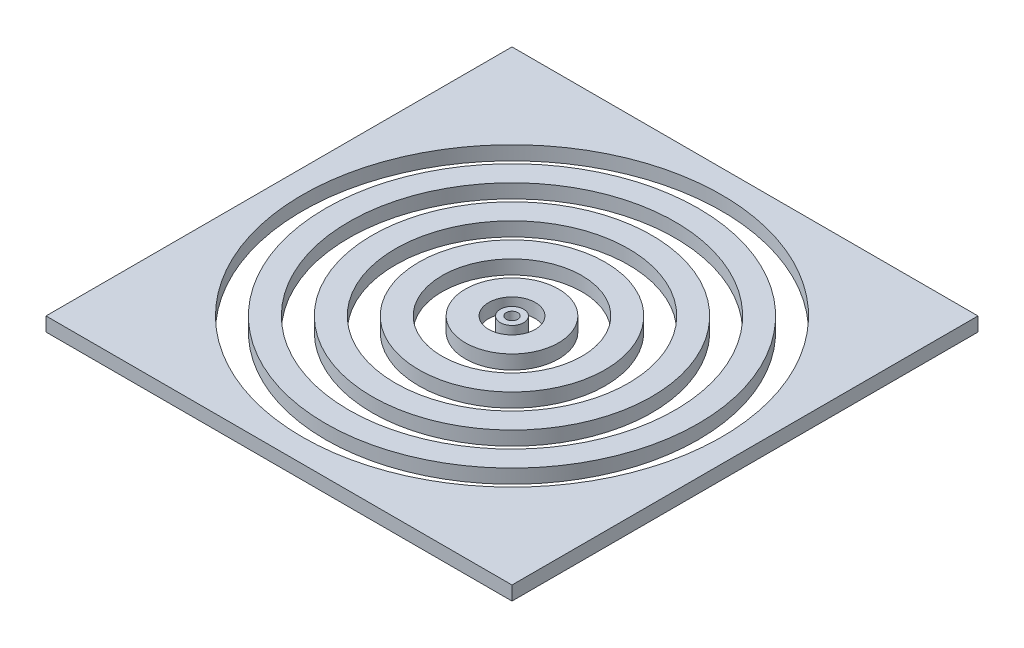
from build123d import *

# Parameters (mm, degrees)
SKETCH1_W           = 100
SKETCH1_H           = 100
BOSS_EXTRUDE1_DEPTH = 3
SKETCH2_R           = 45
CUT_EXTRUDE1_DEPTH  = 3
SKETCH3_R           = 40
BOSS_EXTRUDE2_DEPTH = 3
SKETCH4_R           = 35
CUT_EXTRUDE2_DEPTH  = 3
SKETCH5_R           = 30
BOSS_EXTRUDE3_DEPTH = 3
SKETCH6_R           = 25
CUT_EXTRUDE3_DEPTH  = 3
SKETCH7_R           = 20
BOSS_EXTRUDE4_DEPTH = 3
SKETCH8_R           = 15
CUT_EXTRUDE4_DEPTH  = 3
SKETCH9_R           = 10
BOSS_EXTRUDE5_DEPTH = 3
SKETCH10_R          = 5
CUT_EXTRUDE5_DEPTH  = 3
SKETCH11_R          = 2.5
BOSS_EXTRUDE6_DEPTH = 3
SKETCH12_R          = 1.25
CUT_EXTRUDE6_DEPTH  = 3


with BuildPart() as part:
    # Sketch1 → Boss-Extrude1 (new body)
    with BuildSketch(Plane(origin=(0, 0, 0), x_dir=(1, 0, 0), z_dir=(0, 1, 0))):
        with Locations((50, 50)):
            Rectangle(SKETCH1_W, SKETCH1_H)
    extrude(amount=BOSS_EXTRUDE1_DEPTH)

    # Sketch2 → Cut-Extrude1 (cut)
    with BuildSketch(Plane(origin=(0, 3, 0), x_dir=(1, 0, 0), z_dir=(0, 1, 0))):
        with Locations(Location((50, 50, 0), (0, 0, 270))):
            Circle(SKETCH2_R)
    extrude(amount=-CUT_EXTRUDE1_DEPTH, mode=Mode.SUBTRACT)


with BuildPart() as body_2:
    # Sketch3 → Boss-Extrude2 (new body)
    with BuildSketch(Plane(origin=(0, 3, 0), x_dir=(1, 0, 0), z_dir=(0, 1, 0))):
        with Locations(Location((50, 50, 0), (0, 0, 270))):
            Circle(SKETCH3_R)
    extrude(amount=-BOSS_EXTRUDE2_DEPTH)

    # Sketch4 → Cut-Extrude2 (cut)
    with BuildSketch(Plane(origin=(0, 3, 0), x_dir=(1, 0, 0), z_dir=(0, 1, 0))):
        with Locations(Location((50, 50, 0), (0, 0, 270))):
            Circle(SKETCH4_R)
    extrude(amount=-CUT_EXTRUDE2_DEPTH, mode=Mode.SUBTRACT)


with BuildPart() as body_3:
    # Sketch5 → Boss-Extrude3 (new body)
    with BuildSketch(Plane(origin=(0, 3, 0), x_dir=(1, 0, 0), z_dir=(0, 1, 0))):
        with Locations(Location((50, 50, 0), (0, 0, 270))):
            Circle(SKETCH5_R)
    extrude(amount=-BOSS_EXTRUDE3_DEPTH)

    # Sketch6 → Cut-Extrude3 (cut)
    with BuildSketch(Plane(origin=(0, 3, 0), x_dir=(1, 0, 0), z_dir=(0, 1, 0))):
        with Locations(Location((50, 50, 0), (0, 0, 270))):
            Circle(SKETCH6_R)
    extrude(amount=-CUT_EXTRUDE3_DEPTH, mode=Mode.SUBTRACT)


with BuildPart() as body_4:
    # Sketch7 → Boss-Extrude4 (new body)
    with BuildSketch(Plane(origin=(0, 3, 0), x_dir=(1, 0, 0), z_dir=(0, 1, 0))):
        with Locations(Location((50, 50, 0), (0, 0, 270))):
            Circle(SKETCH7_R)
    extrude(amount=-BOSS_EXTRUDE4_DEPTH)

    # Sketch8 → Cut-Extrude4 (cut)
    with BuildSketch(Plane(origin=(0, 3, 0), x_dir=(1, 0, 0), z_dir=(0, 1, 0))):
        with Locations(Location((50, 50, 0), (0, 0, 270))):
            Circle(SKETCH8_R)
    extrude(amount=-CUT_EXTRUDE4_DEPTH, mode=Mode.SUBTRACT)


with BuildPart() as body_5:
    # Sketch9 → Boss-Extrude5 (new body)
    with BuildSketch(Plane(origin=(0, 3, 0), x_dir=(1, 0, 0), z_dir=(0, 1, 0))):
        with Locations(Location((50, 50, 0), (0, 0, 270))):
            Circle(SKETCH9_R)
    extrude(amount=-BOSS_EXTRUDE5_DEPTH)

    # Sketch10 → Cut-Extrude5 (cut)
    with BuildSketch(Plane(origin=(0, 3, 0), x_dir=(1, 0, 0), z_dir=(0, 1, 0))):
        with Locations(Location((50, 50, 0), (0, 0, 270))):
            Circle(SKETCH10_R)
    extrude(amount=-CUT_EXTRUDE5_DEPTH, mode=Mode.SUBTRACT)


with BuildPart() as body_6:
    # Sketch11 → Boss-Extrude6 (new body)
    with BuildSketch(Plane(origin=(0, 3, 0), x_dir=(1, 0, 0), z_dir=(0, 1, 0))):
        with Locations(Location((50, 50, 0), (0, 0, 270))):
            Circle(SKETCH11_R)
    extrude(amount=-BOSS_EXTRUDE6_DEPTH)

    # Sketch12 → Cut-Extrude6 (cut)
    with BuildSketch(Plane(origin=(0, 3, 0), x_dir=(1, 0, 0), z_dir=(0, 1, 0))):
        with Locations(Location((50, 50, 0), (0, 0, 270))):
            Circle(SKETCH12_R)
    extrude(amount=-CUT_EXTRUDE6_DEPTH, mode=Mode.SUBTRACT)


solid = Compound([part.part, body_2.part, body_3.part, body_4.part, body_5.part, body_6.part])
